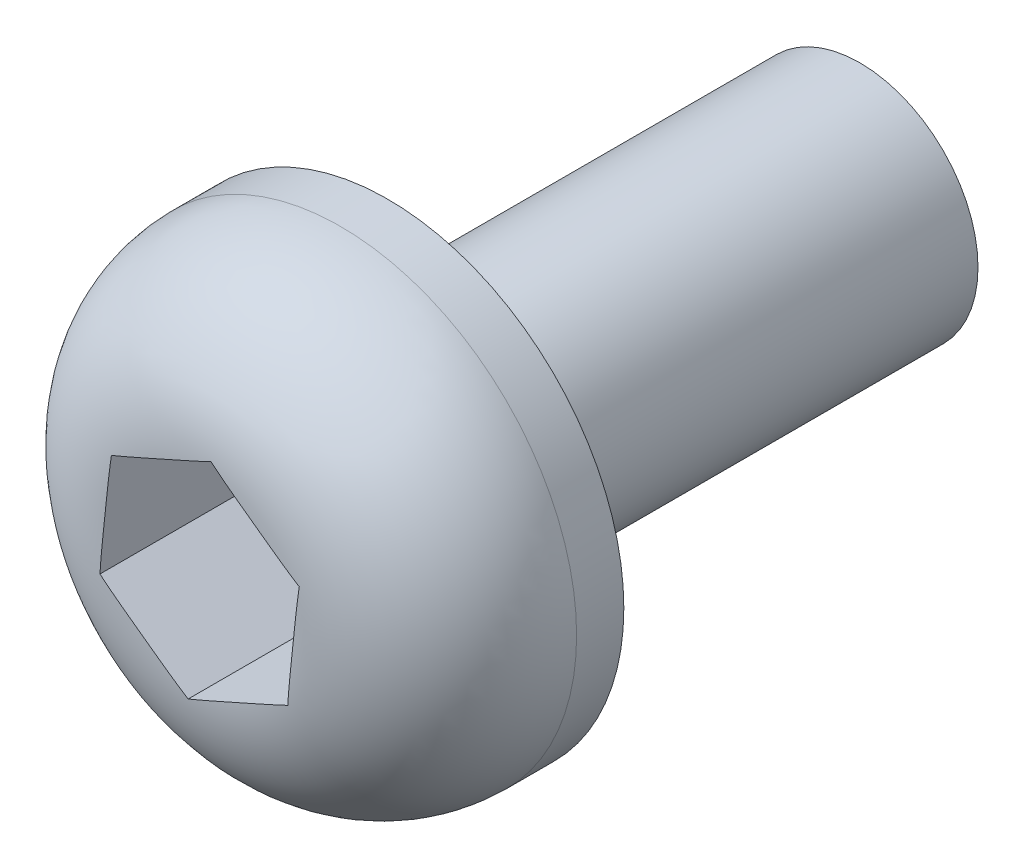
from build123d import *

# Parameters (mm, degrees)
SKETCH_1_R          = 2.5
EXTRUDE_1_DEPTH     = 10
SKETCH_2_R          = 5
EXTRUDE_2_DEPTH     = 4
FILLET_1_R          = 3
CUT_EXTRUDE_1_DEPTH = 3


with BuildPart() as part:
    # 草图1 → 凸台-拉伸1 (new body)
    with BuildSketch(Plane.XY):
        Circle(SKETCH_1_R)
    extrude(amount=EXTRUDE_1_DEPTH)

    # 草图2 → 凸台-拉伸2 (add)
    with BuildSketch(Plane.XY.offset(10)):
        Circle(SKETCH_2_R)
    extrude(amount=EXTRUDE_2_DEPTH)

    # 圆角1
    fillet_1_edges = [part.edges().sort_by_distance(p)[0] for p in [
        (-5, 0, 14),
    ]]
    fillet(fillet_1_edges, radius=FILLET_1_R)

    # 草图3 → 切除-拉伸1 (cut)
    with BuildSketch(Plane.XY.offset(14)):
        Polygon((-0.242384409, -2.296646061), (1.867761628, -1.358234086), (2.110146037, 0.938411975), (0.242384409, 2.296646061), (-1.867761628, 1.358234086), (-2.110146037, -0.938411975), align=None)
    extrude(amount=-CUT_EXTRUDE_1_DEPTH, mode=Mode.SUBTRACT)


solid = part.part
